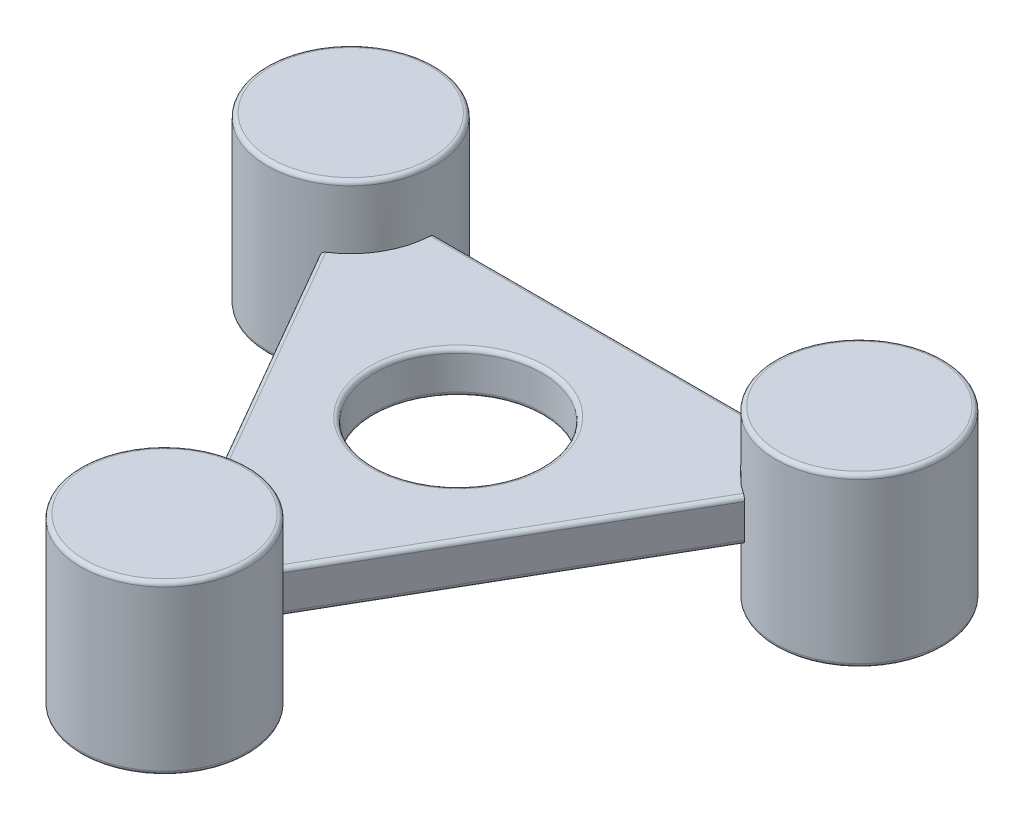
from build123d import *

# Parameters (mm, degrees)
CROQUIS1_R                = 0.3
SALIENTE_EXTRUIR1_DEPTH   = 0.3
SALIENTE_EXTRUIR1_2_DEPTH = 0.3
SALIENTE_EXTRUIR1_3_DEPTH = 0.3
SALIENTE_EXTRUIR2_DEPTH   = 0.075
REDONDEO1_R               = 0.015
REDONDEO2_R               = 0.015
CROQUIS3_R                = 0.3
CORTAR_EXTRUIR1_DEPTH     = 1
REDONDEO3_R               = 0.015


with BuildPart() as part:
    # Croquis1 → Saliente-Extruir1 (new, symmetric)
    with BuildSketch(Plane(origin=(0, 0, 0), x_dir=(1, 0, 0), z_dir=(0, 1, 0))):
        with Locations(Location((-0.909326674, 0.525, 0), (0, 0, 270))):
            Circle(CROQUIS1_R)
    extrude(amount=SALIENTE_EXTRUIR1_DEPTH, both=True)



with BuildPart() as body_2:
    # Croquis1 → Saliente-Extruir1 2 (new, symmetric)
    with BuildSketch(Plane(origin=(0, 0, 0), x_dir=(1, 0, 0), z_dir=(0, 1, 0))):
        with Locations(Location((0.909326674, 0.525, 0), (0, 0, 270))):
            Circle(CROQUIS1_R)
    extrude(amount=SALIENTE_EXTRUIR1_2_DEPTH, both=True)


with BuildPart() as body_3:
    # Croquis1 → Saliente-Extruir1 3 (new, symmetric)
    with BuildSketch(Plane(origin=(0, 0, 0), x_dir=(1, 0, 0), z_dir=(0, 1, 0))):
        with Locations(Location((0, -1.05, 0), (0, 0, 270))):
            Circle(CROQUIS1_R)
    extrude(amount=SALIENTE_EXTRUIR1_3_DEPTH, both=True)


with BuildPart() as part_1:
    add(part.part)

    add(body_2.part)  # Saliente-Extruir2 merges body 2

    add(body_3.part)  # Saliente-Extruir2 merges body 3
    # Croquis2 → Saliente-Extruir2 (add, symmetric)
    with BuildSketch(Plane(origin=(0, 0, 0), x_dir=(1, 0, 0), z_dir=(0, 1, 0))):
        Polygon((-0.909326674, 0.525), (0.909326674, 0.525), (0, -1.05), align=None)
    extrude(amount=SALIENTE_EXTRUIR2_DEPTH, both=True)

    # Redondeo1
    redondeo1_edges = [part_1.edges().sort_by_distance(p)[0] for p in [
        (-0.454663337, -0.075, 0.2625),
        (-0.454663337, 0.075, 0.2625),
        (0, -0.075, -0.525),
        (0, 0.075, -0.525),
        (0.454663337, -0.075, 0.2625),
        (0.454663337, 0.075, 0.2625),
    ]]
    fillet(redondeo1_edges, radius=REDONDEO1_R)

    # Redondeo2
    redondeo2_edges = [part_1.edges().sort_by_distance(p)[0] for p in [
        (-0.909326674, -0.3, -0.825),
        (0.909326674, -0.3, -0.825),
        (0.909326674, 0.3, -0.825),
        (0, -0.3, 0.75),
        (0, 0.3, 0.75),
        (-0.909326674, 0.3, -0.825),
    ]]
    fillet(redondeo2_edges, radius=REDONDEO2_R)

    # Croquis3 → Cortar-Extruir1 (cut)
    with BuildSketch(Plane(origin=(0, 0.075, 0), x_dir=(1, 0, 0), z_dir=(0, 1, 0))):
        with Locations(Location((0, 0, 0), (0, 0, 270))):
            Circle(CROQUIS3_R)
    extrude(amount=-CORTAR_EXTRUIR1_DEPTH, mode=Mode.SUBTRACT)

    # Redondeo3
    redondeo3_edges = [part_1.edges().sort_by_distance(p)[0] for p in [
        (0, -0.075, -0.3),
        (0, 0.075, -0.3),
    ]]
    fillet(redondeo3_edges, radius=REDONDEO3_R)


solid = part_1.part
